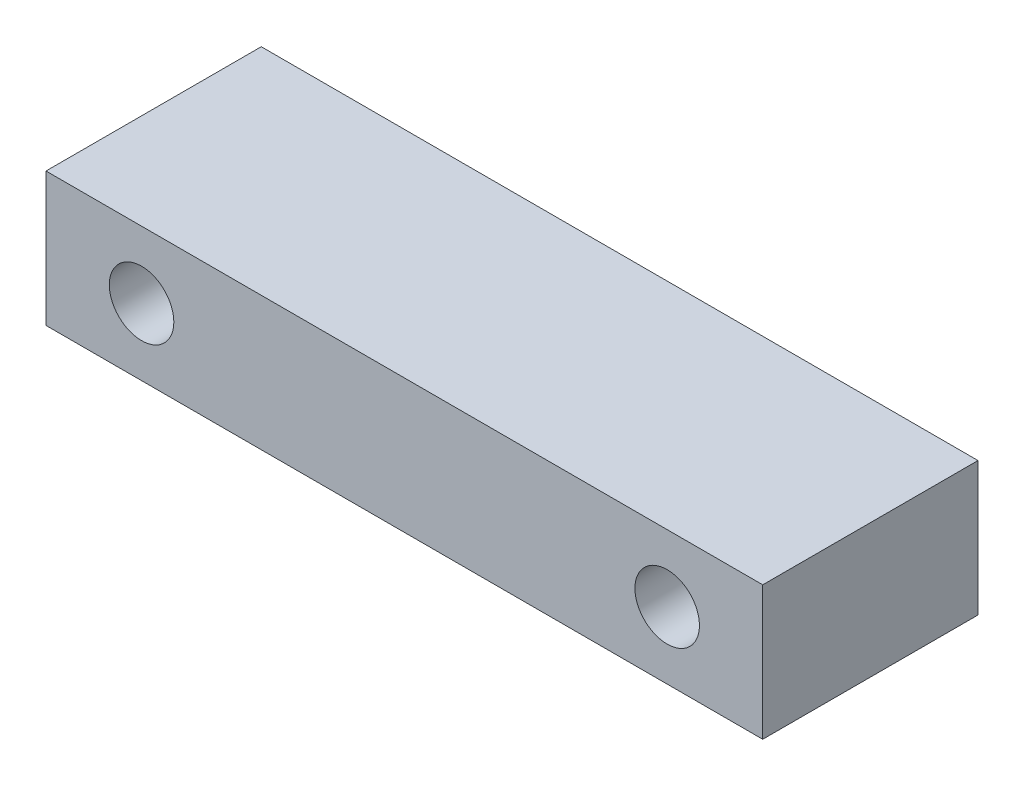
from build123d import *

# Parameters (mm, degrees)
SKETCH_1_W      = 30
SKETCH_1_H      = 5.6
SKETCH_1_R      = 1.35
EXTRUDE_1_DEPTH = 9.01


with BuildPart() as part:
    # 草图1 → 凸台-拉伸1 (new body)
    with BuildSketch(Plane.XY):
        Rectangle(SKETCH_1_W, SKETCH_1_H)
        with Locations((-11, 0)):
            Circle(SKETCH_1_R, mode=Mode.SUBTRACT)
        with Locations(Location((11, 0, 0), (0, 0, 180))):
            Circle(SKETCH_1_R, mode=Mode.SUBTRACT)
    extrude(amount=EXTRUDE_1_DEPTH)


solid = part.part
